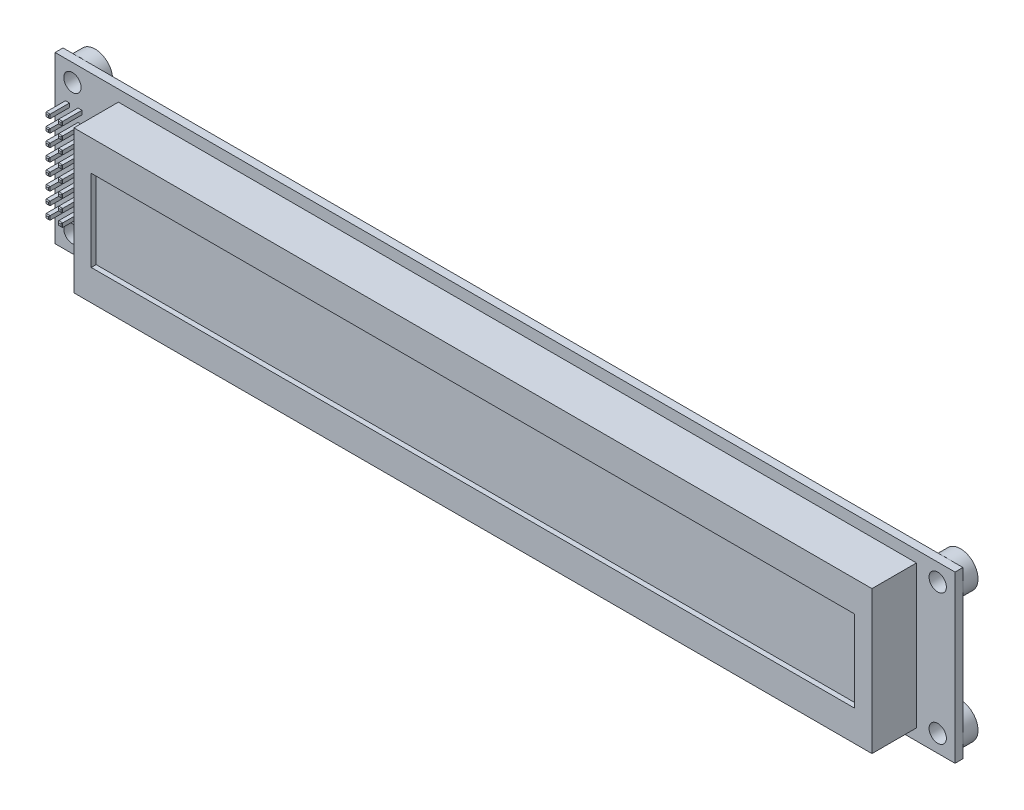
from build123d import *
from OCP.BRepFilletAPI import BRepFilletAPI_MakeChamfer

# Parameters (mm, degrees)
SKETCH_2_W               = 182
SKETCH_2_H               = 33.5
EXTRUDE_1_DEPTH          = 1.6
SKETCH_3_W               = 161.4
SKETCH_3_H               = 28.9
EXTRUDE_2_DEPTH          = 9
SKETCH_4_W               = 154.4
SKETCH_4_H               = 16.5
CUT_EXTRUDE_1_DEPTH      = 1
SKETCH_6_R               = 3.55
EXTRUDE_3_DEPTH          = 3
CUT_EXTRUDE_2_DEPTH      = 94.023343844
CUT_EXTRUDE_2_DEPTH_BACK = 94.023343844
SKETCH_5_R               = 1.75
SKETCH_9_W               = 5
SKETCH_9_H               = 20.32
EXTRUDE_5_DEPTH          = 2.5
EXTRUDE_START            = -5.7
SKETCH_10_W              = 0.8
SKETCH_10_H              = 0.8
EXTRUDE_6_DEPTH          = 11.9
CHAMFER_1_SIZE           = 0.2
CHAMFER_1_SIZE2          = 0.161956807
PATTERN_LINEAR_1_COUNT   = 2
PATTERN_LINEAR_1_PITCH   = 2.54
PATTERN_LINEAR_1_2_COUNT = 8
PATTERN_LINEAR_1_2_PITCH = 2.54


with BuildPart() as part:
    # Эскиз2 → Бобышка-Вытянуть1 (new body)
    with BuildSketch(Plane.XY.offset(-6.6)):
        Rectangle(SKETCH_2_W, SKETCH_2_H)
    extrude(amount=EXTRUDE_1_DEPTH)

    # Эскиз3 → Бобышка-Вытянуть2 (add)
    with BuildSketch(Plane.XY.offset(-5)):
        with Locations((2.5, 0)):
            Rectangle(SKETCH_3_W, SKETCH_3_H)
    extrude(amount=EXTRUDE_2_DEPTH)

    # Эскиз4 → Вырез-Вытянуть1 (cut)
    with BuildSketch(Plane.XY.offset(4)):
        with Locations((2.5, 0)):
            Rectangle(SKETCH_4_W, SKETCH_4_H)
    extrude(amount=-CUT_EXTRUDE_1_DEPTH, mode=Mode.SUBTRACT)

    # Эскиз6 → Бобышка-Вытянуть3 (add)
    with BuildSketch(Plane(origin=(0, 0, -6.6), x_dir=(-1, 0, 0), z_dir=(0, 0, -1))):
        with Locations(Location((-87.5, -13.25, 0), (0, 0, 189.627632683))):
            Circle(SKETCH_6_R)
        with Locations(Location((-87.5, 13.25, 0), (0, 0, 170.372367317))):
            Circle(SKETCH_6_R)
        with Locations(Location((87.5, 13.25, 0), (0, 0, 99.627632683))):
            Circle(SKETCH_6_R)
        with Locations(Location((87.5, -13.25, 0), (0, 0, 260.372367317))):
            Circle(SKETCH_6_R)
    extrude(amount=EXTRUDE_3_DEPTH)

    # Эскиз5 → Вырез-Вытянуть2 (cut, two sides: drawn at the far end of the back side and taken through both)
    with BuildSketch(Plane.XY.offset(-5).offset(-CUT_EXTRUDE_2_DEPTH_BACK)):
        with Locations((-87.5, 13.25)):
            Circle(SKETCH_5_R)
        with Locations((-87.5, -13.25)):
            Circle(SKETCH_5_R)
        with Locations((87.5, -13.25)):
            Circle(SKETCH_5_R)
        with Locations((87.5, 13.25)):
            Circle(SKETCH_5_R)
    extrude(amount=CUT_EXTRUDE_2_DEPTH + CUT_EXTRUDE_2_DEPTH_BACK, mode=Mode.SUBTRACT)

    # Эскиз9 → Бобышка-Вытянуть5 (add)
    with BuildSketch(Plane.XY.offset(-9.6)):
        with Locations((-87.23, 0)):
            Rectangle(SKETCH_9_W, SKETCH_9_H)
    extrude(amount=EXTRUDE_5_DEPTH)


with BuildPart() as body_2:
    # Эскиз10 → Бобышка-Вытянуть6 (new body)
    with BuildSketch(Plane.XY.offset(-7.1).offset(EXTRUDE_START)):
        with Locations((-88.5, 8.95)):
            Rectangle(SKETCH_10_W, SKETCH_10_H)
    extrude(amount=EXTRUDE_6_DEPTH)

    # Фаска1: one chamfer whose edges measure the first distance from different faces: ONE call of the kernel's chamfer builder (chamfer() names one face for all edges)
    chamfer_1_edges_1 = [body_2.edges().sort_by_distance(p)[0] for p in [
        (-88.1, 8.95, -0.9),
    ]]
    chamfer_1_side_1 = [body_2.faces().sort_by_distance(p)[0] for p in [
        (-88.1, 8.95, -6.85),
    ]]
    chamfer_1_edges_2 = [body_2.edges().sort_by_distance(p)[0] for p in [
        (-88.9, 8.95, -12.8),
        (-88.5, 8.55, -12.8),
        (-88.1, 8.95, -12.8),
        (-88.5, 9.35, -12.8),
    ]]
    chamfer_1_side_2 = [body_2.faces().sort_by_distance(p)[0] for p in [
        (-88.5, 8.95, -12.8),
    ]]
    chamfer_1_edges_3 = [body_2.edges().sort_by_distance(p)[0] for p in [
        (-88.5, 9.35, -0.9),
    ]]
    chamfer_1_side_3 = [body_2.faces().sort_by_distance(p)[0] for p in [
        (-88.5, 9.35, -6.85),
    ]]
    chamfer_1_edges_4 = [body_2.edges().sort_by_distance(p)[0] for p in [
        (-88.9, 8.95, -0.9),
    ]]
    chamfer_1_side_4 = [body_2.faces().sort_by_distance(p)[0] for p in [
        (-88.9, 8.95, -6.85),
    ]]
    chamfer_1_edges_5 = [body_2.edges().sort_by_distance(p)[0] for p in [
        (-88.5, 8.55, -0.9),
    ]]
    chamfer_1_side_5 = [body_2.faces().sort_by_distance(p)[0] for p in [
        (-88.5, 8.55, -6.85),
    ]]
    chamfer_1 = BRepFilletAPI_MakeChamfer(body_2.part.solid().wrapped)
    for e in chamfer_1_edges_1:
        chamfer_1.Add(CHAMFER_1_SIZE, CHAMFER_1_SIZE2, e.wrapped, chamfer_1_side_1[0].wrapped)  # the first distance lies on this face
    for e in chamfer_1_edges_2:
        chamfer_1.Add(CHAMFER_1_SIZE, CHAMFER_1_SIZE2, e.wrapped, chamfer_1_side_2[0].wrapped)  # the first distance lies on this face
    for e in chamfer_1_edges_3:
        chamfer_1.Add(CHAMFER_1_SIZE, CHAMFER_1_SIZE2, e.wrapped, chamfer_1_side_3[0].wrapped)  # the first distance lies on this face
    for e in chamfer_1_edges_4:
        chamfer_1.Add(CHAMFER_1_SIZE, CHAMFER_1_SIZE2, e.wrapped, chamfer_1_side_4[0].wrapped)  # the first distance lies on this face
    for e in chamfer_1_edges_5:
        chamfer_1.Add(CHAMFER_1_SIZE, CHAMFER_1_SIZE2, e.wrapped, chamfer_1_side_5[0].wrapped)  # the first distance lies on this face
    add(Compound.cast(chamfer_1.Shape()), mode=Mode.REPLACE)


with BuildPart() as pattern_linear_1_1:
    # Линейный массив1: pattern copy
    add(body_2.part.moved(Location(Vector(1, 0, 0) * (1 * PATTERN_LINEAR_1_PITCH))))


with BuildPart() as pattern_linear_1_2_1:
    # Pattern Linear 1 2: pattern copy
    add(body_2.part.moved(Location(Vector(0, -1, 0) * (1 * PATTERN_LINEAR_1_2_PITCH))))


with BuildPart() as pattern_linear_1_2_2:
    # Pattern Linear 1 2: pattern copy
    add(body_2.part.moved(Location(Vector(0, -1, 0) * (2 * PATTERN_LINEAR_1_2_PITCH))))


with BuildPart() as pattern_linear_1_2_3:
    # Pattern Linear 1 2: pattern copy
    add(body_2.part.moved(Location(Vector(0, -1, 0) * (3 * PATTERN_LINEAR_1_2_PITCH))))


with BuildPart() as pattern_linear_1_2_4:
    # Pattern Linear 1 2: pattern copy
    add(body_2.part.moved(Location(Vector(0, -1, 0) * (4 * PATTERN_LINEAR_1_2_PITCH))))


with BuildPart() as pattern_linear_1_2_5:
    # Pattern Linear 1 2: pattern copy
    add(body_2.part.moved(Location(Vector(0, -1, 0) * (5 * PATTERN_LINEAR_1_2_PITCH))))


with BuildPart() as pattern_linear_1_2_6:
    # Pattern Linear 1 2: pattern copy
    add(body_2.part.moved(Location(Vector(0, -1, 0) * (6 * PATTERN_LINEAR_1_2_PITCH))))


with BuildPart() as pattern_linear_1_2_7:
    # Pattern Linear 1 2: pattern copy
    add(body_2.part.moved(Location(Vector(0, -1, 0) * (7 * PATTERN_LINEAR_1_2_PITCH))))


with BuildPart() as pattern_linear_1_2_8:
    # Pattern Linear 1 2: pattern copy
    add(pattern_linear_1_1.part.moved(Location(Vector(0, -1, 0) * (1 * PATTERN_LINEAR_1_2_PITCH))))


with BuildPart() as pattern_linear_1_2_9:
    # Pattern Linear 1 2: pattern copy
    add(pattern_linear_1_1.part.moved(Location(Vector(0, -1, 0) * (2 * PATTERN_LINEAR_1_2_PITCH))))


with BuildPart() as pattern_linear_1_2_10:
    # Pattern Linear 1 2: pattern copy
    add(pattern_linear_1_1.part.moved(Location(Vector(0, -1, 0) * (3 * PATTERN_LINEAR_1_2_PITCH))))


with BuildPart() as pattern_linear_1_2_11:
    # Pattern Linear 1 2: pattern copy
    add(pattern_linear_1_1.part.moved(Location(Vector(0, -1, 0) * (4 * PATTERN_LINEAR_1_2_PITCH))))


with BuildPart() as pattern_linear_1_2_12:
    # Pattern Linear 1 2: pattern copy
    add(pattern_linear_1_1.part.moved(Location(Vector(0, -1, 0) * (5 * PATTERN_LINEAR_1_2_PITCH))))


with BuildPart() as pattern_linear_1_2_13:
    # Pattern Linear 1 2: pattern copy
    add(pattern_linear_1_1.part.moved(Location(Vector(0, -1, 0) * (6 * PATTERN_LINEAR_1_2_PITCH))))


with BuildPart() as pattern_linear_1_2_14:
    # Pattern Linear 1 2: pattern copy
    add(pattern_linear_1_1.part.moved(Location(Vector(0, -1, 0) * (7 * PATTERN_LINEAR_1_2_PITCH))))


solid = Compound([part.part, body_2.part, pattern_linear_1_1.part, pattern_linear_1_2_1.part, pattern_linear_1_2_2.part, pattern_linear_1_2_3.part, pattern_linear_1_2_4.part, pattern_linear_1_2_5.part, pattern_linear_1_2_6.part, pattern_linear_1_2_7.part, pattern_linear_1_2_8.part, pattern_linear_1_2_9.part, pattern_linear_1_2_10.part, pattern_linear_1_2_11.part, pattern_linear_1_2_12.part, pattern_linear_1_2_13.part, pattern_linear_1_2_14.part])
